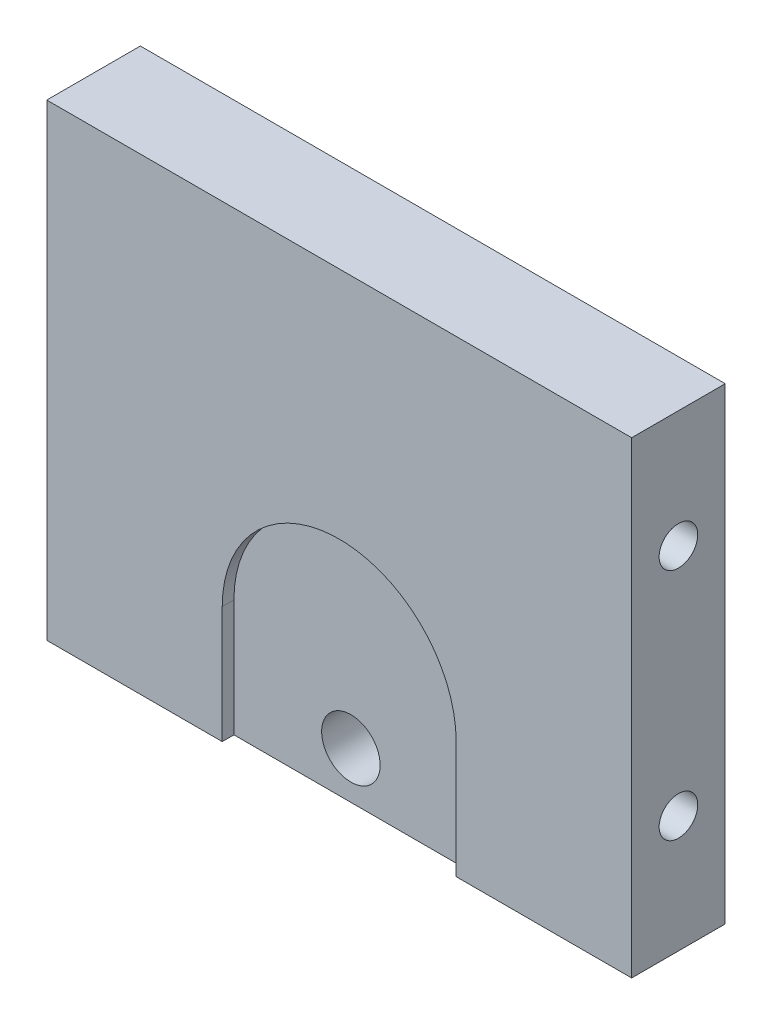
from build123d import *

# Parameters (mm, degrees)
SKETCH_1_W          = 50
SKETCH_1_H          = 40
EXTRUDE_1_DEPTH     = 8
SKETCH_2_R          = 1.65
CUT_EXTRUDE_1_DEPTH = 15
CUT_EXTRUDE_2_DEPTH = 1
SKETCH_4_R          = 2.5
CUT_EXTRUDE_3_DEPTH = 10


with BuildPart() as part:
    # Эскиз1 → Бобышка-Вытянуть1 (new body)
    with BuildSketch(Plane.XY):
        Rectangle(SKETCH_1_W, SKETCH_1_H)
    extrude(amount=EXTRUDE_1_DEPTH)

    # Эскиз2 → Вырез-Вытянуть1 (cut)
    with BuildSketch(Plane(origin=(25, 0, 0), x_dir=(0, 0, -1), z_dir=(1, 0, 0))):
        with Locations(Location((-4, 10, 0), (0, 0, 90))):
            Circle(SKETCH_2_R)
        with Locations(Location((-4, -10, 0), (0, 0, 90))):
            Circle(SKETCH_2_R)
    extrude(amount=-CUT_EXTRUDE_1_DEPTH, mode=Mode.SUBTRACT)

    # Эскиз3 → Вырез-Вытянуть2 (cut)
    with BuildSketch(Plane.XY.offset(8)):
        with BuildLine():
            Line((-10, -20), (10, -20))
            Line((10, -20), (10, -10))
            ThreePointArc((10, -10), (0, 0), (-10, -10))
            Line((-10, -10), (-10, -20))
        make_face()
    extrude(amount=-CUT_EXTRUDE_2_DEPTH, mode=Mode.SUBTRACT)

    # Эскиз4 → Вырез-Вытянуть3 (cut)
    with BuildSketch(Plane.XY.offset(7)):
        with Locations((0, -16)):
            Circle(SKETCH_4_R)
    extrude(amount=-CUT_EXTRUDE_3_DEPTH, mode=Mode.SUBTRACT)


solid = part.part
